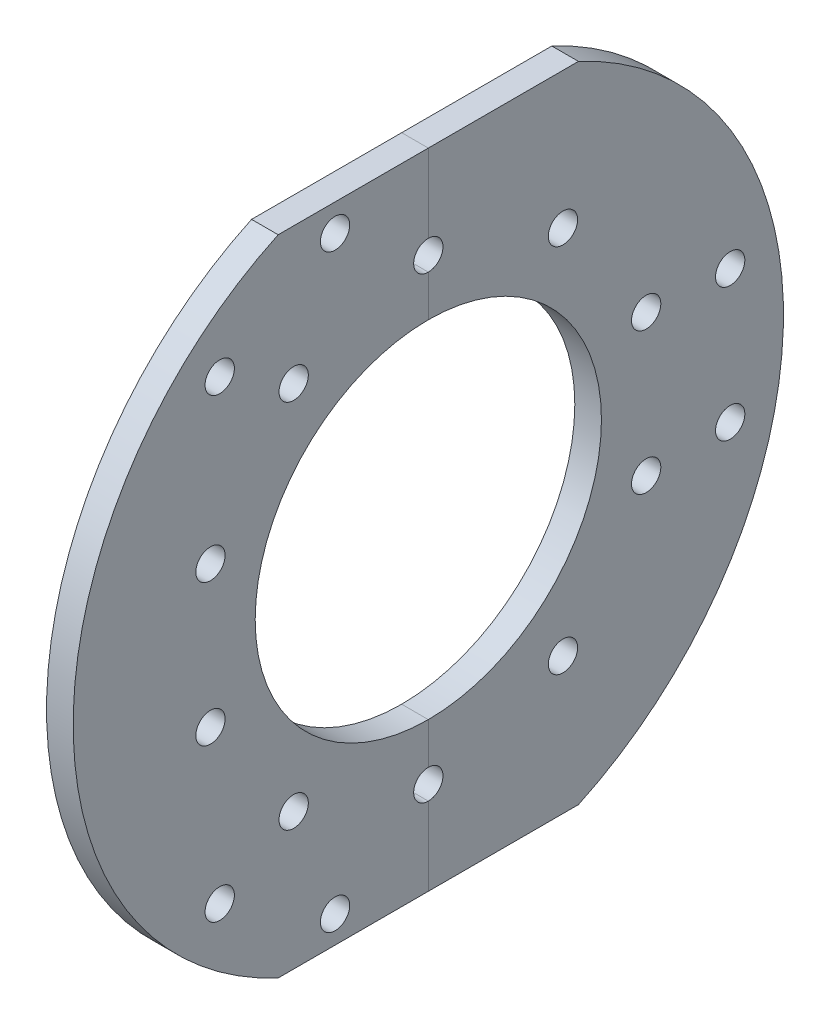
from build123d import *

# Parameters (mm, degrees)
SKETCH1_R           = 3.3
SKETCH1_R_2         = 39
BOSS_EXTRUDE1_DEPTH = 6


with BuildPart() as part:
    # Sketch1 → Boss-Extrude1 (new body)
    with BuildSketch(Plane(origin=(0, 0, 0), x_dir=(0, 0, -1), z_dir=(1, 0, 0))):
        with BuildLine():
            Line((-33.819373146, -72.5), (33.819373146, -72.5))
            ThreePointArc((33.819373146, -72.5), (80, 0), (33.819373146, 72.5))
            Line((33.819373146, 72.5), (-33.819373146, 72.5))
            ThreePointArc((-33.819373146, 72.5), (-80, 0), (-33.819373146, -72.5))
        make_face()
        with Locations((-46.990381057, 51.389727457)):
            Circle(SKETCH1_R, mode=Mode.SUBTRACT)
        with Locations((-21.009618943, 66.389727457)):
            Circle(SKETCH1_R, mode=Mode.SUBTRACT)
        with Locations((-21.009618943, -66.389727457)):
            Circle(SKETCH1_R, mode=Mode.SUBTRACT)
        with Locations((-46.990381057, -51.389727457)):
            Circle(SKETCH1_R, mode=Mode.SUBTRACT)
        with Locations((68, -15)):
            Circle(SKETCH1_R, mode=Mode.SUBTRACT)
        with Locations((68, 15)):
            Circle(SKETCH1_R, mode=Mode.SUBTRACT)
        with Locations((0, 51.6)):
            Circle(SKETCH1_R, mode=Mode.SUBTRACT)
        with Locations((30.329719018, 41.74527691)):
            Circle(SKETCH1_R, mode=Mode.SUBTRACT)
        with Locations((49.074516241, 15.94527691)):
            Circle(SKETCH1_R, mode=Mode.SUBTRACT)
        with Locations((49.074516241, -15.94527691)):
            Circle(SKETCH1_R, mode=Mode.SUBTRACT)
        with Locations((30.329719018, -41.74527691)):
            Circle(SKETCH1_R, mode=Mode.SUBTRACT)
        with Locations((0, -51.6)):
            Circle(SKETCH1_R, mode=Mode.SUBTRACT)
        with Locations((-30.329719018, -41.74527691)):
            Circle(SKETCH1_R, mode=Mode.SUBTRACT)
        with Locations((-49.074516241, -15.94527691)):
            Circle(SKETCH1_R, mode=Mode.SUBTRACT)
        with Locations((-49.074516241, 15.94527691)):
            Circle(SKETCH1_R, mode=Mode.SUBTRACT)
        with Locations((-30.329719018, 41.74527691)):
            Circle(SKETCH1_R, mode=Mode.SUBTRACT)
        Circle(SKETCH1_R_2, mode=Mode.SUBTRACT)
    extrude(amount=BOSS_EXTRUDE1_DEPTH)


with BuildPart() as body_2:
    # Split1: the piece on the far side of the plane
    add(part.part)
    split(bisect_by=Plane.XY, keep=Keep.BOTTOM)


with BuildPart() as part_1:
    add(part.part)

    # Split1
    split(bisect_by=Plane.XY, keep=Keep.TOP)


solid = Compound([body_2.part, part_1.part])
